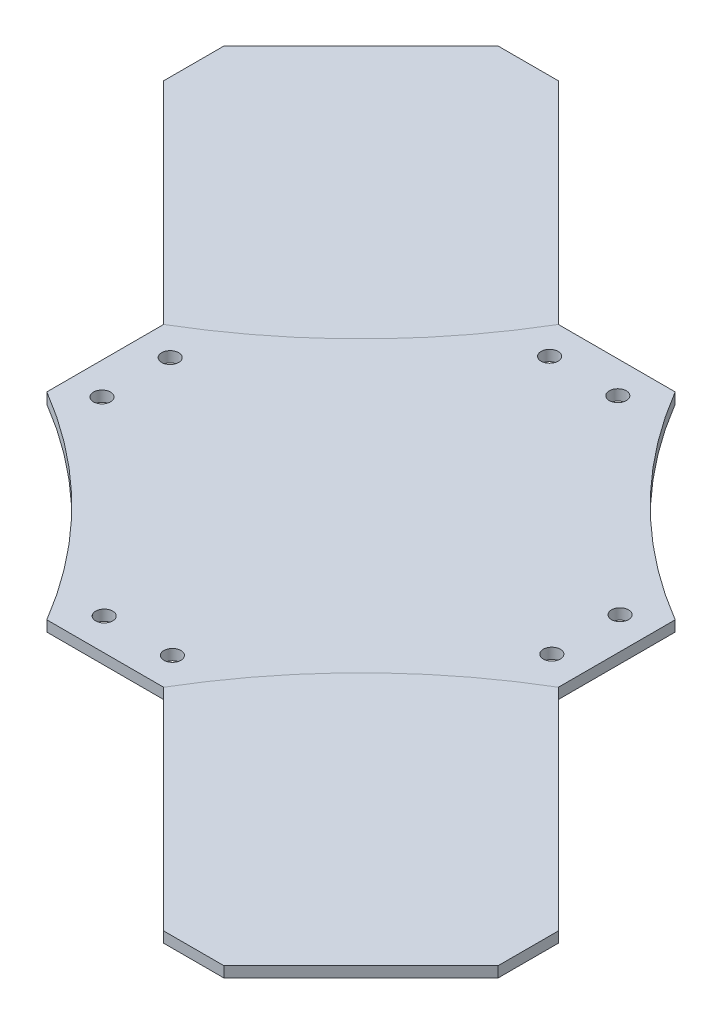
from build123d import *

# Parameters (mm, degrees)
BOSS_EXTRUDE1_DEPTH = 2.5
SKETCH3_R           = 2
CUT_EXTRUDE1_DEPTH  = 2.5
CIRPATTERN1_COUNT   = 4
BOSS_EXTRUDE2_DEPTH = 2.5


with BuildPart() as part:
    # Sketch1 → Boss-Extrude1 (new body)
    with BuildSketch(Plane(origin=(0, 0, 0), x_dir=(1, 0, 0), z_dir=(0, 1, 0))):
        with BuildLine():
            Line((-13.7, 60), (13.7, 60))
            ThreePointArc((13.7, 60), (33.917107936, 33.917107936), (60, 13.7))
            Line((60, 13.7), (60, -13.7))
            ThreePointArc((60, -13.7), (33.917107936, -33.917107936), (13.7, -60))
            Line((13.7, -60), (-13.7, -60))
            ThreePointArc((-13.7, -60), (-33.917107936, -33.917107936), (-60, -13.7))
            Line((-60, -13.7), (-60, 13.7))
            ThreePointArc((-60, 13.7), (-33.917107936, 33.917107936), (-13.7, 60))
        make_face()
    extrude(amount=BOSS_EXTRUDE1_DEPTH)

    # Sketch3 → Cut-Extrude1 (cut)
    with BuildSketch(Plane(origin=(0, 2.5, 0), x_dir=(1, 0, 0), z_dir=(0, 1, 0))):
        with Locations((-8.259716624, 52.5)):
            Circle(SKETCH3_R)
        with Locations((7.740283376, 52.5)):
            Circle(SKETCH3_R)
    cut_extrude1 = extrude(amount=-CUT_EXTRUDE1_DEPTH, mode=Mode.SUBTRACT)

    # CirPattern1: Cut-Extrude1 ×4 about axis
    cirpattern1_axis = Axis((0, 0, 0), (0, 1, 0))
    for i in range(1, CIRPATTERN1_COUNT):
        add(cut_extrude1.rotate(cirpattern1_axis, i * 360 / CIRPATTERN1_COUNT), mode=Mode.SUBTRACT)


with BuildPart() as body_2:
    # Sketch4 → Boss-Extrude2 (new body)
    with BuildSketch(Plane(origin=(0, 2.5, 0), x_dir=(1, 0, 0), z_dir=(0, 1, 0))):
        with BuildLine():
            Line((-60, 13.7), (-109.497474683, 63.197474683))
            Line((-109.497474683, 63.197474683), (-109.497474683, 77.339610307))
            Line((-109.497474683, 77.339610307), (-77.339610307, 109.497474683))
            Line((-77.339610307, 109.497474683), (-63.197474683, 109.497474683))
            Line((-63.197474683, 109.497474683), (-13.7, 60))
            ThreePointArc((-13.7, 60), (-33.917107936, 33.917107936), (-60, 13.7))
        make_face()
    extrude(amount=-BOSS_EXTRUDE2_DEPTH)


with BuildPart() as body_3:
    # Mirror3: mirrored copy
    add(body_2.part.mirror(Plane(origin=(0, 0, 0), x_dir=(-0.7071067811865492, 0, 0.7071067811865459), z_dir=(-0.707106781186546, 0, -0.7071067811865491))))


solid = Compound([part.part, body_2.part, body_3.part])
